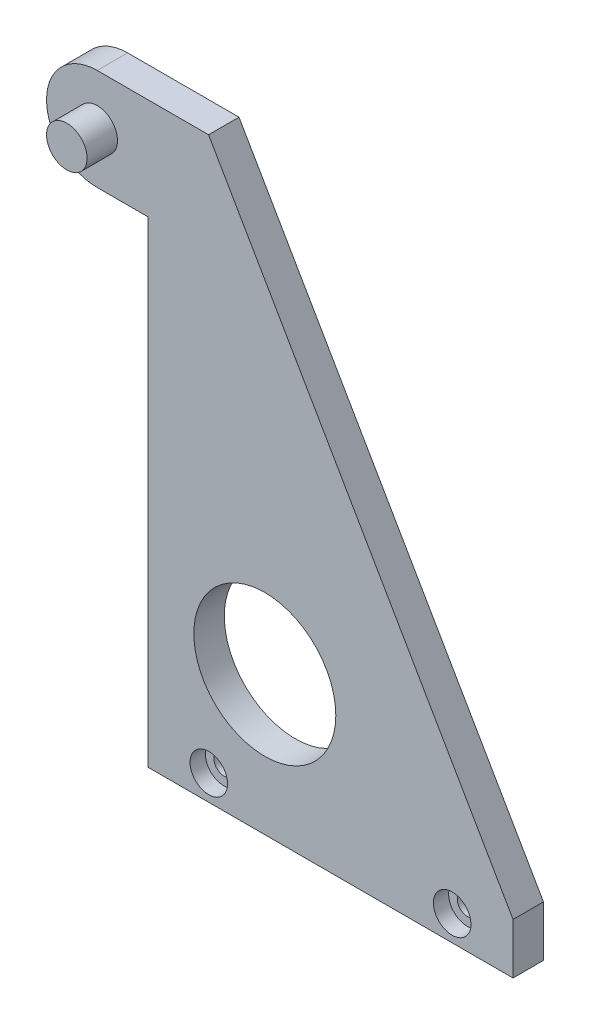
from build123d import *

# Parameters (mm, degrees)
EXTRUDE_1_DEPTH     = 3
SKETCH_3_R          = 7
CUT_EXTRUDE_1_DEPTH = 64.576725301
SKETCH_4_R          = 1
CUT_EXTRUDE_2_DEPTH = 64.576725301
SKETCH_5_R          = 2
EXTRUDE_2_DEPTH     = 3
FILLET_1_RADIUS     = 5
FILLET_1_LENGTH     = 3
SKETCH_6_R          = 1.85
CUT_EXTRUDE_3_DEPTH = 1.5


with BuildPart() as part:
    # 草图1 → 凸台-拉伸1 (new body)
    with BuildSketch(Plane.XY):
        Polygon((-18, 0), (18, 0), (18, 5), (-12.022213998, 57), (-28, 57), (-28, 47), (-18, 47), align=None)
    extrude(amount=EXTRUDE_1_DEPTH)

    # 草图3 → 切除-拉伸1 (cut, through all)
    with BuildSketch(Plane.XY.offset(3)):
        with Locations((-6.476357534, 13.687539211)):
            Circle(SKETCH_3_R)
    extrude(amount=-CUT_EXTRUDE_1_DEPTH, mode=Mode.SUBTRACT)

    # 草图4 → 切除-拉伸2 (cut, through all)
    with BuildSketch(Plane.XY.offset(3)):
        with Locations((12, 2.5)):
            Circle(SKETCH_4_R)
        with Locations(Location((-12, 2.5, 0), (0, 0, 180))):
            Circle(SKETCH_4_R)
    extrude(amount=-CUT_EXTRUDE_2_DEPTH, mode=Mode.SUBTRACT)

    # 草图5 → 凸台-拉伸2 (add)
    with BuildSketch(Plane.XY.offset(3)):
        with Locations(Location((-23, 52, 0), (0, 0, 180))):
            Circle(SKETCH_5_R)
    extrude(amount=EXTRUDE_2_DEPTH)

    # 圆角1: full round fillet: the end face becomes a half cylinder, R = half its width
    fillet_1_face = Plane((-28, 52, 1.5), x_dir=(0, 0, 1), z_dir=(-1, 0, 0))  # on the end face: x along it, z out of the body
    fillet_1_slab = fillet_1_face.offset(-FILLET_1_RADIUS / 2) * Box(FILLET_1_LENGTH, 2 * FILLET_1_RADIUS, FILLET_1_RADIUS, mode=Mode.PRIVATE)  # the body's end, R deep
    fillet_1_round = Plane((-23, 52, 1.5), x_dir=(-1, 0, 0), z_dir=(0, 0, 1)) * Cylinder(FILLET_1_RADIUS, FILLET_1_LENGTH, mode=Mode.PRIVATE)  # its axis R under the face
    add(fillet_1_slab - fillet_1_round, mode=Mode.SUBTRACT)

    # 草图6 → 切除-拉伸3 (cut)
    with BuildSketch(Plane.XY.offset(3)):
        with Locations((12, 2.5)):
            Circle(SKETCH_6_R)
        with Locations((-12, 2.5)):
            Circle(SKETCH_6_R)
    extrude(amount=-CUT_EXTRUDE_3_DEPTH, mode=Mode.SUBTRACT)


solid = part.part
